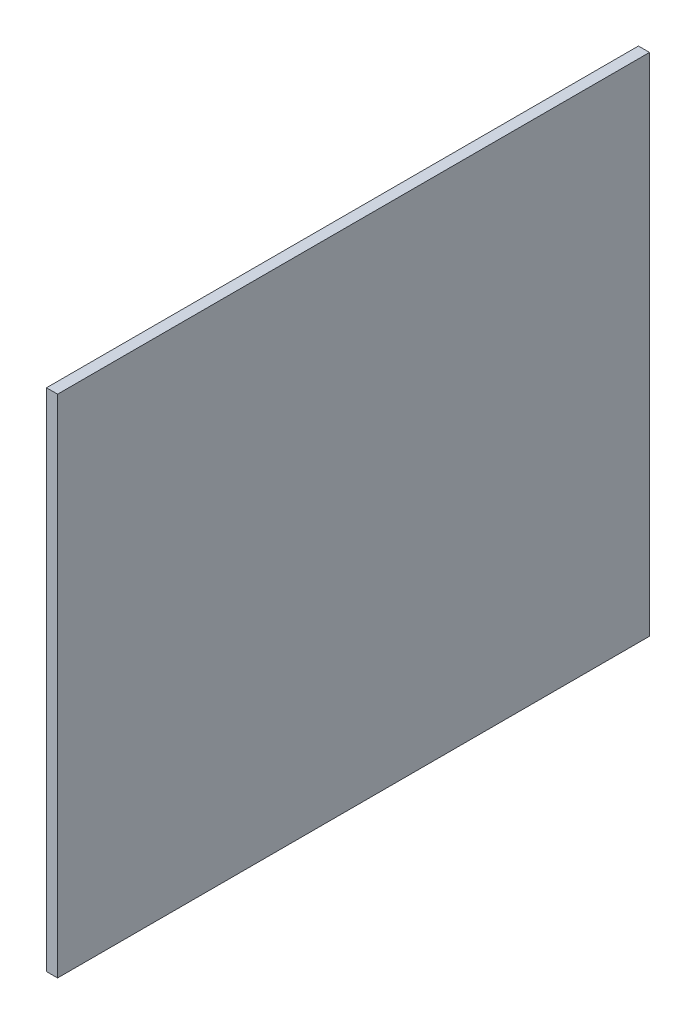
from build123d import *

# Parameters (mm, degrees)
SKETCH1_W           = 960
SKETCH1_H           = 820
BOSS_EXTRUDE1_DEPTH = 18


with BuildPart() as part:
    # Sketch1 → Boss-Extrude1 (new body)
    with BuildSketch(Plane(origin=(0, 0, 0), x_dir=(0, 0, -1), z_dir=(1, 0, 0))):
        Rectangle(SKETCH1_W, SKETCH1_H)
    extrude(amount=BOSS_EXTRUDE1_DEPTH)


solid = part.part
